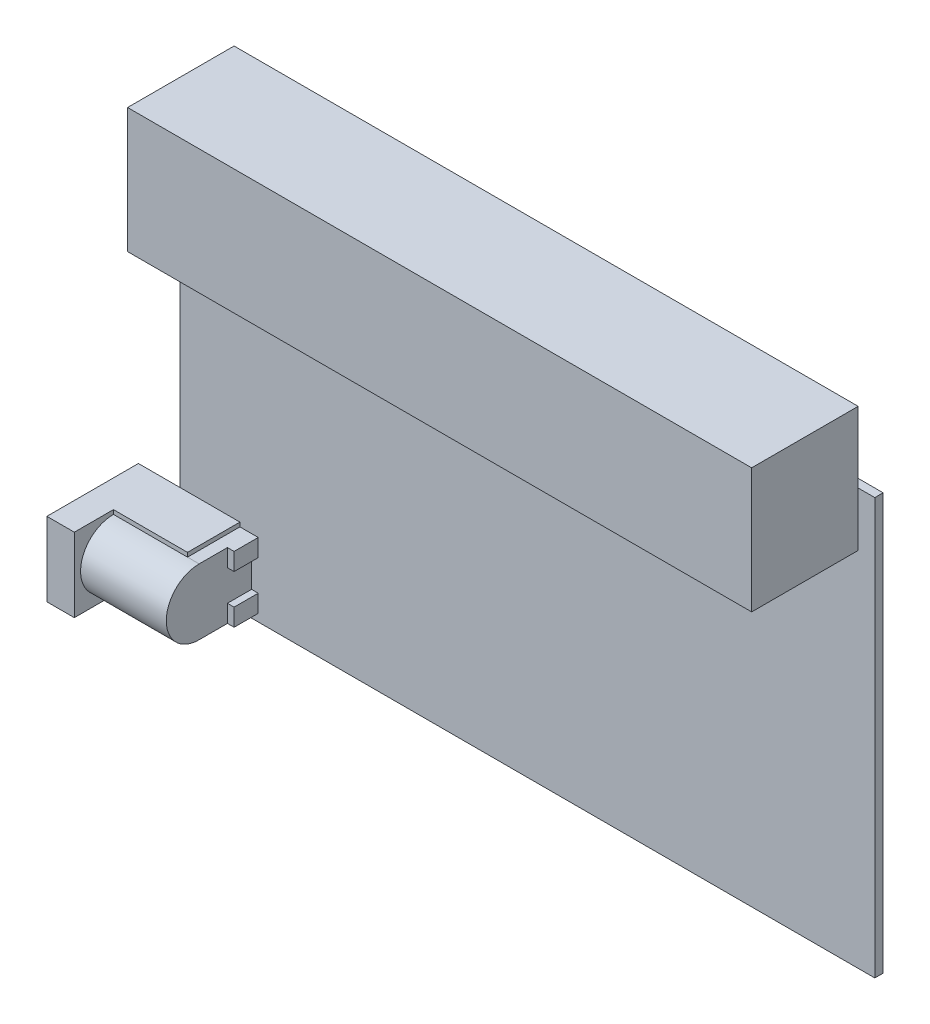
from build123d import *

# Parameters (mm, degrees)
SKETCH1_W           = 83.5
SKETCH1_H           = 50
BOSS_EXTRUDE1_DEPTH = 1
SKETCH2_W           = 75
SKETCH2_H           = 15
BOSS_EXTRUDE2_DEPTH = 12.8
SKETCH3_W           = 3.3
SKETCH3_H           = 8.9
BOSS_EXTRUDE3_DEPTH = 11
BOSS_EXTRUDE4_DEPTH = 10.3
BOSS_EXTRUDE6_DEPTH = 0.5
BOSS_EXTRUDE7_DEPTH = 0.5
SKETCH7_W           = 2.9
SKETCH7_H           = 2.1
BOSS_EXTRUDE8_DEPTH = 0.8
SKETCH8_R           = 2.25
CUT_EXTRUDE1_DEPTH  = 12.2


with BuildPart() as part:
    # Sketch1 → Boss-Extrude1 (new body)
    with BuildSketch(Plane.XY):
        Rectangle(SKETCH1_W, SKETCH1_H)
    extrude(amount=BOSS_EXTRUDE1_DEPTH)

    # Sketch2 → Boss-Extrude2 (add)
    with BuildSketch(Plane.XY.offset(1)):
        with Locations((2.25, 26)):
            Rectangle(SKETCH2_W, SKETCH2_H)
    extrude(amount=BOSS_EXTRUDE2_DEPTH)



with BuildPart() as body_2:
    # Sketch3 → Boss-Extrude3 (new body)
    with BuildSketch(Plane.XY.offset(1)):
        with Locations((-45.1, -20.15)):
            Rectangle(SKETCH3_W, SKETCH3_H)
    extrude(amount=BOSS_EXTRUDE3_DEPTH)


with BuildPart() as part_1:
    add(part.part)

    add(body_2.part)  # Boss-Extrude4 merges body 2
    # Sketch4 → Boss-Extrude4 (add)
    with BuildSketch(Plane(origin=(-43.45, 0, 0), x_dir=(0, 0, -1), z_dir=(1, 0, 0))):
        with BuildLine():
            Line((-7.3, -16.2), (-1, -16.2))
            Line((-1, -16.2), (-1, -24.1))
            Line((-1, -24.1), (-7.3, -24.1))
            ThreePointArc((-7.3, -24.1), (-11.25, -20.15), (-7.3, -16.2))
        make_face()
    extrude(amount=BOSS_EXTRUDE4_DEPTH)

    # Sketch5 → Boss-Extrude6 (add)
    with BuildSketch(Plane.XZ.offset(24.1)):
        Polygon((-34.55, 7.3), (-34.55, 1), (-41.75, 1), (-43.45, 1), (-43.45, 7.3), align=None)
    extrude(amount=BOSS_EXTRUDE6_DEPTH)

    # Sketch6 → Boss-Extrude7 (add)
    with BuildSketch(Plane(origin=(0, -16.2, 0), x_dir=(1, 0, 0), z_dir=(0, 1, 0))):
        Polygon((-43.45, -7.3), (-34.55, -7.3), (-34.55, -1), (-41.75, -1), (-43.45, -1), align=None)
    extrude(amount=BOSS_EXTRUDE7_DEPTH)

    # Sketch7 → Boss-Extrude8 (add)
    with BuildSketch(Plane(origin=(-33.15, 0, 0), x_dir=(0, 0, -1), z_dir=(1, 0, 0))):
        with Locations((-2.45, -23.05)):
            Rectangle(SKETCH7_W, SKETCH7_H)
        with Locations((-2.45, -17.25)):
            Rectangle(SKETCH7_W, SKETCH7_H)
    extrude(amount=BOSS_EXTRUDE8_DEPTH)

    # Sketch8 → Cut-Extrude1 (cut)
    with BuildSketch(Plane.ZY.offset(46.75)):
        with Locations((7.3, -20.15)):
            Circle(SKETCH8_R)
    extrude(amount=-CUT_EXTRUDE1_DEPTH, mode=Mode.SUBTRACT)


solid = part_1.part
